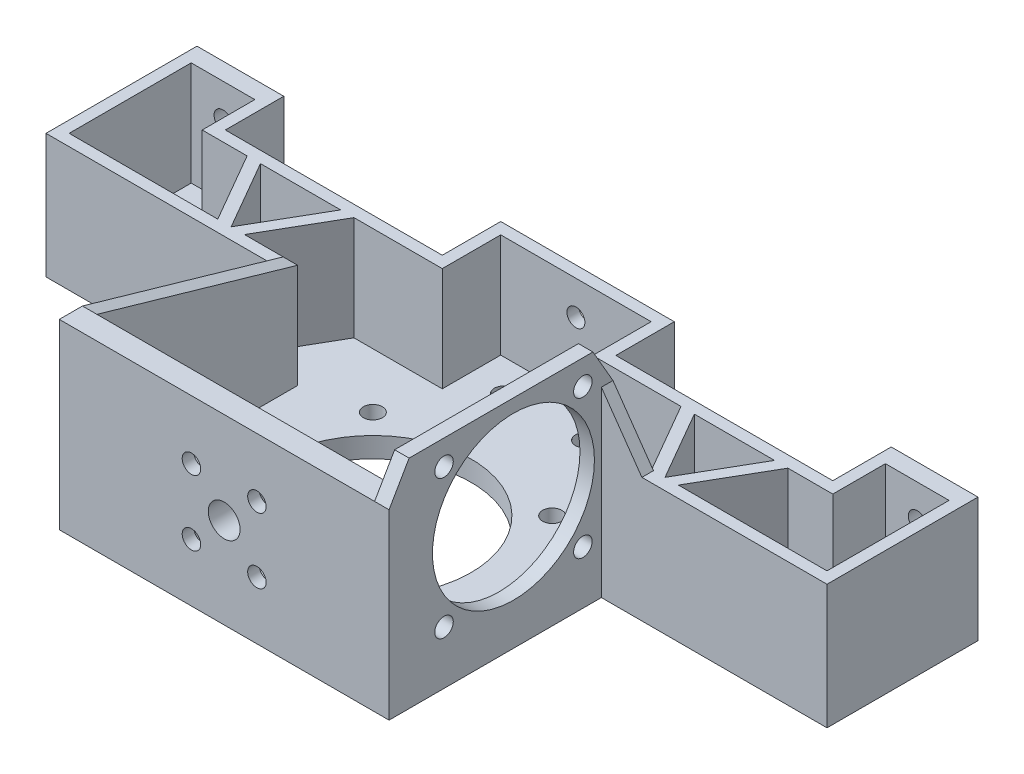
from build123d import *

# Parameters (mm, degrees)
SKETCH_2_R          = 1.6
SKETCH_2_R_2        = 17
SKETCH_2_R_3        = 1.65
EXTRUDE_2_DEPTH     = 3.5
EXTRUDE_3_DEPTH     = 18
EXTRUDE_4_DEPTH     = 10
CUT_EXTRUDE_5_DEPTH = 3
SKETCH_10_R         = 2.75
SKETCH_10_R_2       = 1.6
CUT_EXTRUDE_4_DEPTH = 5
EXTRUDE_5_DEPTH     = 18
SKETCH_14_R         = 1.55
CUT_EXTRUDE_6_DEPTH = 10
CUT_EXTRUDE_7_DEPTH = 2
EXTRUDE_6_DEPTH     = 2
EXTRUDE_7_DEPTH     = 2.5
SKETCH_21_R         = 1.6
SKETCH_21_R_2       = 14
CUT_EXTRUDE_8_DEPTH = 3


with BuildPart() as part:
    # 草图2 → 凸台-拉伸2 (new body)
    with BuildSketch(Plane(origin=(0, 0, 0), x_dir=(1, 0, 0), z_dir=(0, 1, 0))):
        Polygon((-39, 36.7), (-39, 62.8), (-24, 62.8), (-24, 52.7), (13.5, 52.7), (13.5, 62.8), (43.5, 62.8), (43.5, 52.7), (81, 52.7), (81, 62.8), (96, 62.8), (96, 36.7), (57, 36.7), (57, 0), (0, 0), (0, 36.7), align=None)
        with Locations(Location((-31.5, 55.3, 0), (0, 0, 270))):
            Circle(SKETCH_2_R, mode=Mode.SUBTRACT)
        with Locations(Location((88.5, 55.3, 0), (0, 0, 270))):
            Circle(SKETCH_2_R, mode=Mode.SUBTRACT)
        with Locations(Location((21.5, 55.3, 0), (0, 0, 270))):
            Circle(SKETCH_2_R, mode=Mode.SUBTRACT)
        with Locations(Location((35.5, 55.3, 0), (0, 0, 270))):
            Circle(SKETCH_2_R, mode=Mode.SUBTRACT)
        with Locations(Location((28.5, 25.7, 0), (0, 0, 270))):
            Circle(SKETCH_2_R_2, mode=Mode.SUBTRACT)
        with Locations(Location((44, 41.2, 0), (0, 0, 270))):
            Circle(SKETCH_2_R_3, mode=Mode.SUBTRACT)
        with Locations(Location((44, 10.2, 0), (0, 0, 270))):
            Circle(SKETCH_2_R_3, mode=Mode.SUBTRACT)
        with Locations(Location((13, 10.2, 0), (0, 0, 270))):
            Circle(SKETCH_2_R_3, mode=Mode.SUBTRACT)
        with Locations(Location((13, 41.2, 0), (0, 0, 270))):
            Circle(SKETCH_2_R_3, mode=Mode.SUBTRACT)
    extrude(amount=EXTRUDE_2_DEPTH)

    # 草图6 → 凸台-拉伸3 (add)
    with BuildSketch(Plane(origin=(0, 3.5, 0), x_dir=(1, 0, 0), z_dir=(0, 1, 0))):
        Polygon((13.5, 52.7), (-24, 52.7), (-24, 62.8), (-39, 62.8), (-39, 36.7), (0, 36.7), (0, 0), (57, 0), (57, 36.7), (96, 36.7), (96, 62.8), (81, 62.8), (81, 52.7), (43.5, 52.7), (43.5, 62.8), (13.5, 62.8), align=None)
        Polygon((15.5, 50.7), (-26, 50.7), (-26, 59.8), (-37, 59.8), (-37, 38.7), (2.5, 38.7), (2.5, 4), (54.5, 4), (54.5, 38.7), (94, 38.7), (94, 59.8), (83, 59.8), (83, 50.7), (41.5, 50.7), (41.5, 60.8), (15.5, 60.8), align=None, mode=Mode.SUBTRACT)
    extrude(amount=EXTRUDE_3_DEPTH)

    # 草图11 → 凸台-拉伸4 (add)
    with BuildSketch(Plane(origin=(0, 21.5, 0), x_dir=(1, 0, 0), z_dir=(0, 1, 0))):
        Polygon((2.5, 38.7), (2.5, 4), (54.5, 4), (54.5, 38.7), (57, 38.7), (57, 0), (0, 0), (0, 38.7), align=None)
    extrude(amount=EXTRUDE_4_DEPTH)

    # 草图12 → 切除-拉伸5 (cut)
    with BuildSketch(Plane.ZY):
        Polygon((-38.7, 21.5), (-4, 31.5), (-38.7, 31.5), align=None)
    extrude(amount=-CUT_EXTRUDE_5_DEPTH, mode=Mode.SUBTRACT)

    # 草图10 → 切除-拉伸4 (cut)
    with BuildSketch(Plane.XY):
        with Locations((28.5, 15.656854249)):
            Circle(SKETCH_10_R)
        with Locations((34.156854249, 21.313708499)):
            Circle(SKETCH_10_R_2)
        with Locations((34.156854249, 10)):
            Circle(SKETCH_10_R_2)
        with Locations((22.843145751, 10)):
            Circle(SKETCH_10_R_2)
        with Locations((22.843145751, 21.313708499)):
            Circle(SKETCH_10_R_2)
    extrude(amount=-CUT_EXTRUDE_4_DEPTH, mode=Mode.SUBTRACT)

    # 草图13 → 凸台-拉伸5 (add)
    with BuildSketch(Plane(origin=(0, 3.5, 0), x_dir=(1, 0, 0), z_dir=(0, 1, 0))):
        Polygon((-9, 38.7), (-15.92820323, 50.7), (-18.237604307, 50.7), (-11.309401077, 38.7), align=None)
        Polygon((-2.07179677, 50.7), (-9, 38.7), (-6.690598923, 38.7), (0.237604307, 50.7), align=None)
        Polygon((56.762395693, 50.7), (63.690598923, 38.7), (66, 38.7), (59.07179677, 50.7), align=None)
        Polygon((72.92820323, 50.7), (66, 38.7), (68.309401077, 38.7), (75.237604307, 50.7), align=None)
    extrude(amount=EXTRUDE_5_DEPTH)

    # 草图14 → 切除-拉伸6 (cut)
    with BuildSketch(Plane(origin=(0, 0, -62.8), x_dir=(-1, 0, 0), z_dir=(0, 0, -1))):
        with Locations((31.5, 15.656854249)):
            Circle(SKETCH_14_R)
        with Locations(Location((-88.5, 15.656854249, 0), (0, 0, 180))):
            Circle(SKETCH_14_R)
        with Locations((-28.5, 15.656854249)):
            Circle(SKETCH_14_R)
    extrude(amount=-CUT_EXTRUDE_6_DEPTH, mode=Mode.SUBTRACT)

    # 草图20 → 切除-拉伸7 (cut)
    with BuildSketch(Plane(origin=(0, 0, -4), x_dir=(-1, 0, 0), z_dir=(0, 0, -1))):
        Polygon((-25.843145751, 19.581657691), (-22.843145751, 17.849606884), (-19.843145751, 19.581657691), (-19.843145751, 23.045759307), (-22.843145751, 24.777810114), (-25.843145751, 23.045759307), align=None)
        Polygon((-32.424803442, 18.313708499), (-30.692752634, 21.313708499), (-32.424803442, 24.313708499), (-35.888905057, 24.313708499), (-37.620955865, 21.313708499), (-35.888905057, 18.313708499), align=None)
        Polygon((-24.575196558, 13), (-26.307247366, 10), (-24.575196558, 7), (-21.111094943, 7), (-19.379044135, 10), (-21.111094943, 13), align=None)
        Polygon((-31.156854249, 11.732050808), (-34.156854249, 13.464101615), (-37.156854249, 11.732050808), (-37.156854249, 8.267949192), (-34.156854249, 6.535898385), (-31.156854249, 8.267949192), align=None)
    extrude(amount=-CUT_EXTRUDE_7_DEPTH, mode=Mode.SUBTRACT)

    # 草图22 → 凸台-拉伸6 (add)
    with BuildSketch(Plane(origin=(0, 0, -38.7), x_dir=(-1, 0, 0), z_dir=(0, 0, -1))):
        Polygon((-57, 31.5), (-64.002075382, 21.5), (-57, 21.5), align=None)
    extrude(amount=-EXTRUDE_6_DEPTH)

    # 草图24 → 凸台-拉伸7 (add)
    with BuildSketch(Plane(origin=(57, 0, 0), x_dir=(0, 0, -1), z_dir=(1, 0, 0))):
        Polygon((0, 31.5), (3.464101615, 37.5), (35.235898385, 37.5), (38.7, 31.5), align=None)
    extrude(amount=-EXTRUDE_7_DEPTH)

    # 草图21 → 切除-拉伸8 (cut)
    with BuildSketch(Plane(origin=(57, 0, 0), x_dir=(0, 0, -1), z_dir=(1, 0, 0))):
        with Locations((9.5, 33.2)):
            Circle(SKETCH_21_R)
        with Locations((33.5, 33.2)):
            Circle(SKETCH_21_R)
        with Locations((33.5, 9.2)):
            Circle(SKETCH_21_R)
        with Locations((9.5, 9.2)):
            Circle(SKETCH_21_R)
        with Locations((21.5, 21.2)):
            Circle(SKETCH_21_R_2)
    extrude(amount=-CUT_EXTRUDE_8_DEPTH, mode=Mode.SUBTRACT)


solid = part.part
